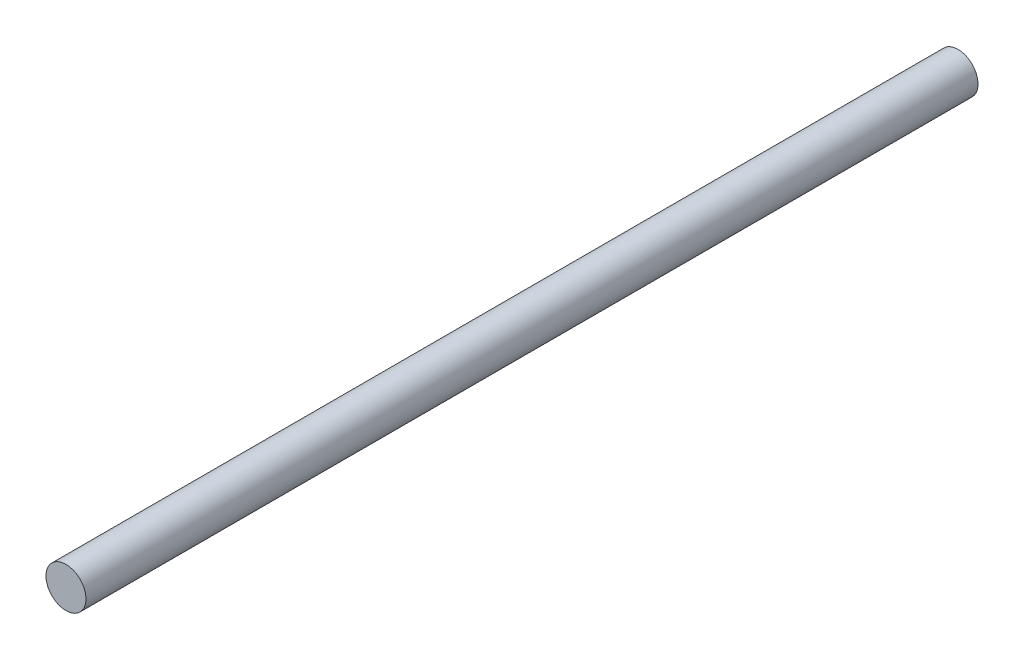
from build123d import *

# Parameters (mm, degrees)
SKETCH1_R           = 3.365
BOSS_EXTRUDE1_DEPTH = 150


with BuildPart() as part:
    # Sketch1 → Boss-Extrude1 (new body)
    with BuildSketch(Plane.XY):
        Circle(SKETCH1_R)
    extrude(amount=BOSS_EXTRUDE1_DEPTH)


solid = part.part
